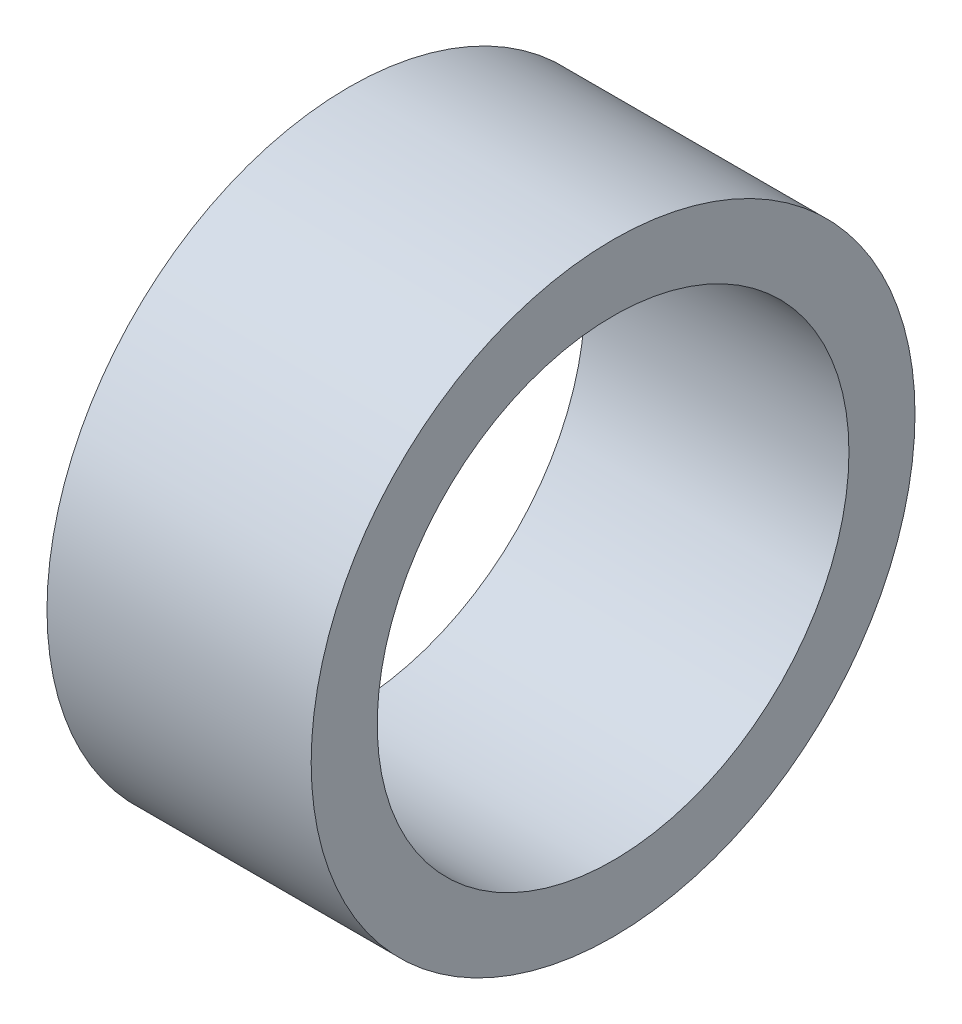
from build123d import *

# Parameters (mm, degrees)
SKETCH_1_R      = 8
SKETCH_1_R_2    = 6.25
EXTRUDE_1_DEPTH = 7


with BuildPart() as part:
    # ｽｹｯﾁ1 → ﾎﾞｽ - 押し出し1 (new body)
    with BuildSketch(Plane(origin=(0, 0, 0), x_dir=(0, 0, -1), z_dir=(1, 0, 0))):
        Circle(SKETCH_1_R)
        Circle(SKETCH_1_R_2, mode=Mode.SUBTRACT)
    extrude(amount=EXTRUDE_1_DEPTH)


solid = part.part
